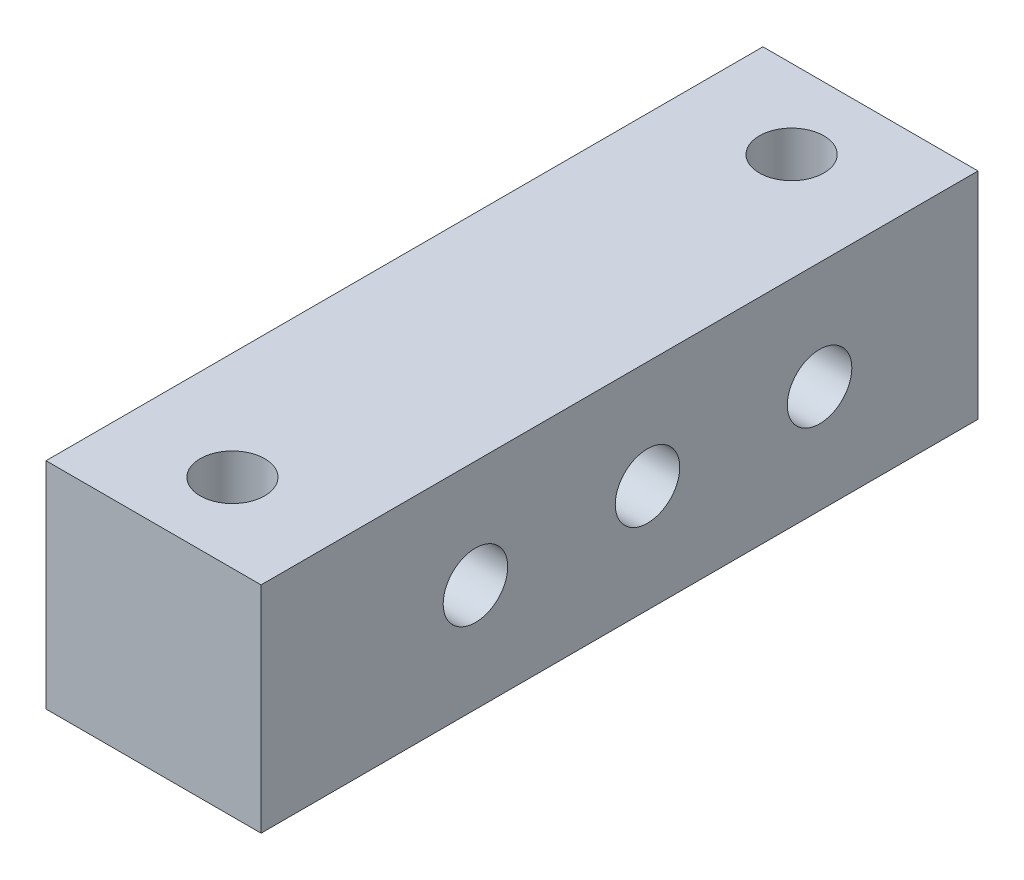
from build123d import *

# Parameters (mm, degrees)
ESQUISSE1_W             = 15
ESQUISSE1_H             = 15
BOSS_EXTRU_1_DEPTH      = 50
ESQUISSE2_R             = 2.25
ENL_V_MAT_EXTRU_1_DEPTH = 55.313902456
ESQUISSE3_R             = 2.25
ENL_V_MAT_EXTRU_2_DEPTH = 55.313902456


with BuildPart() as part:
    # Esquisse1 → Boss.-Extru.1 (new body)
    with BuildSketch(Plane.XY):
        with Locations((7.5, 7.5)):
            Rectangle(ESQUISSE1_W, ESQUISSE1_H)
    extrude(amount=BOSS_EXTRU_1_DEPTH)

    # Esquisse2 → Enlèv. mat.-Extru.1 (cut, through all)
    with BuildSketch(Plane(origin=(0, 15, 0), x_dir=(1, 0, 0), z_dir=(0, 1, 0))):
        with Locations(Location((7.5, -44.5, 0), (0, 0, 270))):
            Circle(ESQUISSE2_R)
        with Locations(Location((7.5, -5.5, 0), (0, 0, 90))):
            Circle(ESQUISSE2_R)
    extrude(amount=-ENL_V_MAT_EXTRU_1_DEPTH, mode=Mode.SUBTRACT)

    # Esquisse3 → Enlèv. mat.-Extru.2 (cut, through all)
    with BuildSketch(Plane.ZY):
        with Locations((23.05, 7.5)):
            Circle(ESQUISSE3_R)
        with Locations((35.05, 7.5)):
            Circle(ESQUISSE3_R)
        with Locations(Location((11.05, 7.5, 0), (0, 0, 180))):
            Circle(ESQUISSE3_R)
    extrude(amount=-ENL_V_MAT_EXTRU_2_DEPTH, mode=Mode.SUBTRACT)


solid = part.part
